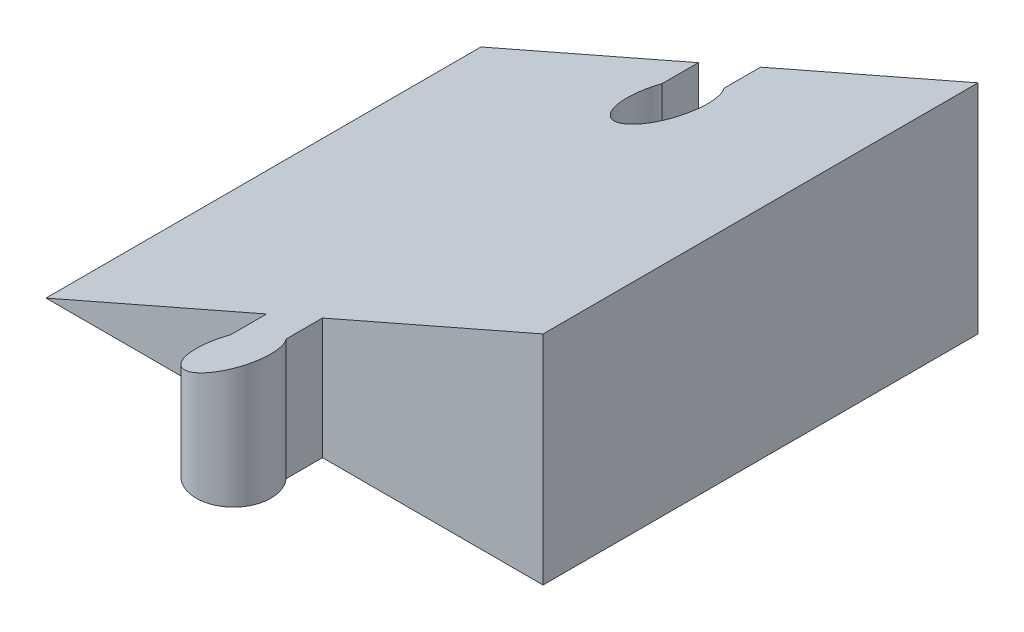
from build123d import *

# Parameters (mm, degrees)
RESSALTO_EXTRUS_O1_DEPTH = 70
RESSALTO_EXTRUS_O2_REACH = 92.865
CORTE_EXTRUS_O1_DEPTH    = 70


with BuildPart() as part:
    # Esboço1 → Ressalto-extrusão1 (new body)
    with BuildSketch(Plane.XY):
        Polygon((-46.166666667, -15.652777778), (33.833333333, 19.347222222), (33.833333333, -15.652777778), align=None)
    extrude(amount=RESSALTO_EXTRUS_O1_DEPTH)

    # Ressalto-extrusão2: up to this plane
    ressalto_extrus_o2_end = Plane(origin=(-46.166666667, -15.652777778, 70), z_dir=(0.4008188340197078, -0.9161573349021892, 0))
    # Esboço3 → Ressalto-extrusão2 (add, up to the surface)
    with BuildSketch(Plane.XZ.offset(15.652777778), mode=Mode.PRIVATE) as ressalto_extrus_o2_sk1:
        with BuildLine():
            Line((-10.666666667, 70), (-1.666666667, 70))
            Line((-1.666666667, 70), (-1.666666667, 75.846688069))
            ThreePointArc((-1.666666667, 75.846688069), (-6.166666667, 85.815315035), (-10.666666667, 75.846688069))
            Line((-10.666666667, 75.846688069), (-10.666666667, 70))
        make_face()
    ressalto_extrus_o2_tool1 = split(extrude(ressalto_extrus_o2_sk1.sketch, amount=-RESSALTO_EXTRUS_O2_REACH, mode=Mode.PRIVATE), bisect_by=ressalto_extrus_o2_end, keep=Keep.BOTH, mode=Mode.PRIVATE)
    add(ressalto_extrus_o2_tool1.solids().sort_by_distance((-6.166667, -15.652778, 77.842662))[0])

    # Esboço2 → Corte-extrusão1 (cut)
    with BuildSketch(Plane.XZ.offset(15.652777778)):
        with BuildLine():
            Line((-11.166666667, 0), (-1.166666667, 0))
            Line((-1.166666667, 0), (-1.166666667, 5.846688069))
            ThreePointArc((-1.166666667, 5.846688069), (-6.166666667, 16.5), (-11.166666667, 5.846688069))
            Line((-11.166666667, 5.846688069), (-11.166666667, 0))
        make_face()
    extrude(amount=-CORTE_EXTRUS_O1_DEPTH, mode=Mode.SUBTRACT)


solid = part.part
